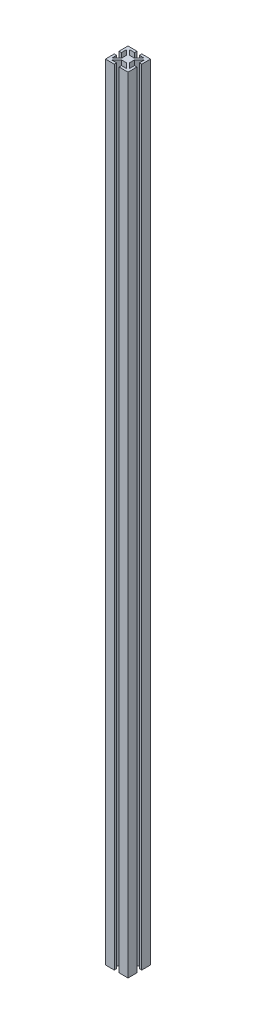
from build123d import *

# Parameters (mm, degrees)
BOSS_EXTRUDE1_DEPTH = 1320.8


with BuildPart() as part:
    # Sketch2 → Boss-Extrude1 (new body)
    with BuildSketch(Plane(origin=(0.594697292, 0, 0.594697292), x_dir=(1, 0, 0), z_dir=(0, 1, 0))):
        Polygon((-19.644697292, 19.644697292), (-4.658697292, 19.644697292), (-4.658697292, 15.580697292), (-12.707015333, 15.580697292), (-4.477415333, 7.351097292), (3.288020749, 7.351097292), (11.517620749, 15.580697292), (3.469302708, 15.580697292), (3.469302708, 19.644697292), (18.455302708, 19.644697292), (18.455302708, 4.658697292), (14.391302708, 4.658697292), (14.391302708, 12.707015333), (6.161702708, 4.477415333), (6.161702708, -3.288020749), (14.391302708, -11.517620749), (14.391302708, -3.469302708), (18.455302708, -3.469302708), (18.455302708, -18.455302708), (3.469302708, -18.455302708), (3.469302708, -14.391302708), (11.517620749, -14.391302708), (3.288020749, -6.161702708), (-4.477415333, -6.161702708), (-12.707015333, -14.391302708), (-4.658697292, -14.391302708), (-4.658697292, -18.455302708), (-19.644697292, -18.455302708), (-19.644697292, -3.469302708), (-15.580697292, -3.469302708), (-15.580697292, -11.517620749), (-7.351097292, -3.288020749), (-7.351097292, 4.477415333), (-15.580697292, 12.707015333), (-15.580697292, 4.658697292), (-19.644697292, 4.658697292), align=None)
    extrude(amount=BOSS_EXTRUDE1_DEPTH)


solid = part.part
